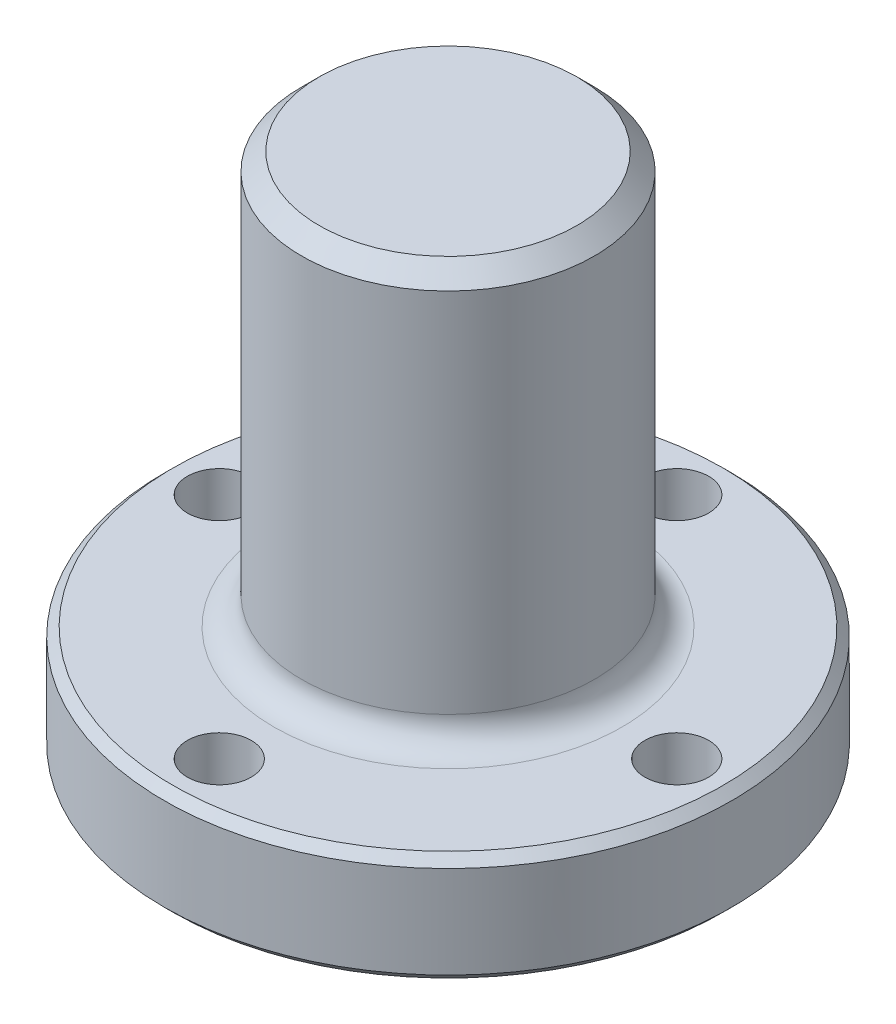
from build123d import *

# Parameters (mm, degrees)
FILLET1_R          = 2.3876
CHAMFER1_SIZE      = 0.762
CHAMFER2_SIZE      = 1.524
CUT_EXTRUDE2_START = -10.6807
SKETCH2_R          = 2.7686
CUT_EXTRUDE2_DEPTH = 10.6807


with BuildPart() as part:
    # Sketch1 → Revolve1 (revolve)
    with BuildSketch(Plane(origin=(0, 0, 0), x_dir=(0, 1, 0), z_dir=(0, 0, 1)), mode=Mode.PRIVATE) as revolve1_sk:
        Polygon((-25.0317, 0), (-25.0317, 8.7122), (-20.2057, 8.7122), (-20.2057, 24.6126), (-10.6807, 24.6126), (-10.6807, 12.7), (25.0317, 12.7), (25.0317, 0), align=None)
    revolve(revolve1_sk.sketch.rotate(Axis((0, -50.4317, 0), (0, 1, 0)), 270), axis=Axis((0, -50.4317, 0), (0, 1, 0)))

    # Fillet1
    fillet1_edges = [part.edges().sort_by_distance(p)[0] for p in [
        (0, -10.6807, 12.7),
    ]]
    fillet(fillet1_edges, radius=FILLET1_R)

    # Chamfer1
    chamfer1_edges = [part.edges().sort_by_distance(p)[0] for p in [
        (0, -10.6807, 24.6126),
        (0, -20.2057, 24.6126),
        (0, -25.0317, 8.7122),
    ]]
    chamfer(chamfer1_edges, length=CHAMFER1_SIZE)

    # Chamfer2
    chamfer2_edges = [part.edges().sort_by_distance(p)[0] for p in [
        (0, 25.0317, 12.7),
    ]]
    chamfer(chamfer2_edges, length=CHAMFER2_SIZE)

    # Sketch2 → Cut-Extrude2 (cut)
    with BuildSketch(Plane(origin=(0, 0, 0), x_dir=(-1, 0, 0), z_dir=(0, 1, 0)).offset(CUT_EXTRUDE2_START)):
        with Locations(Location((19.8374, 0, 0), (0, 0, 90))):
            Circle(SKETCH2_R)
        with Locations(Location((0, 19.8374, 0), (0, 0, 90))):
            Circle(SKETCH2_R)
        with Locations(Location((-19.8374, 0, 0), (0, 0, 90))):
            Circle(SKETCH2_R)
        with Locations(Location((0, -19.8374, 0), (0, 0, 90))):
            Circle(SKETCH2_R)
    extrude(amount=-CUT_EXTRUDE2_DEPTH, mode=Mode.SUBTRACT)


solid = part.part
